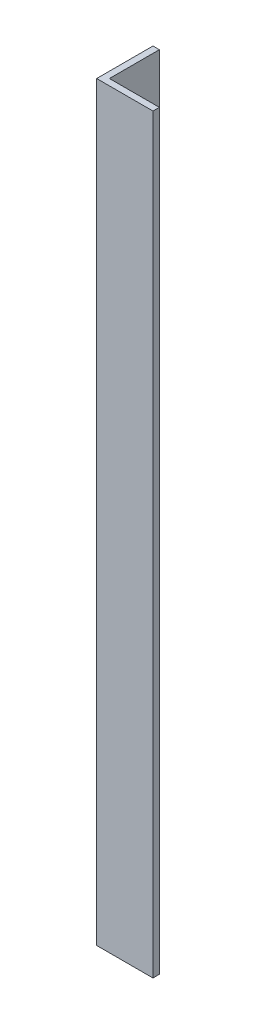
from build123d import *

# Parameters (mm, degrees)
BOSS_EXTRUDE1_DEPTH = 400


with BuildPart() as part:
    # Sketch1 → Boss-Extrude1 (new body)
    with BuildSketch(Plane(origin=(0, 0, 0), x_dir=(1, 0, 0), z_dir=(0, 1, 0))):
        Polygon((0, 0), (0, 30), (3.4, 30), (3.4, 3.4), (30, 3.4), (30, 0), align=None)
    extrude(amount=BOSS_EXTRUDE1_DEPTH)


solid = part.part
